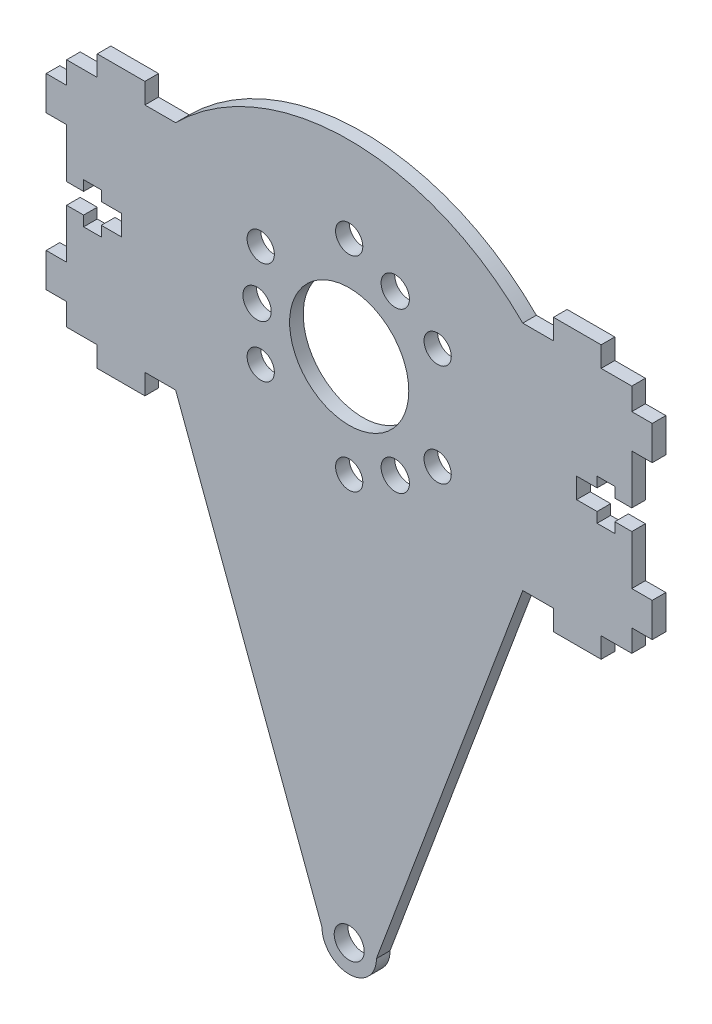
from build123d import *

# Parameters (mm, degrees)
SKETCH_1_R      = 2
SKETCH_1_R_2    = 2.08
SKETCH_1_R_3    = 8.75
SKETCH_1_R_4    = 2.2
EXTRUDE_2_DEPTH = 2


with BuildPart() as part:
    # 草图1 → 凸台-拉伸2 (new body)
    with BuildSketch(Plane.XY):
        with BuildLine():
            Line((41.5, 13.75), (41.5, 17))
            Line((41.5, 17), (37, 17))
            Line((37, 17), (37, 20))
            Line((37, 20), (30, 20))
            Line((30, 20), (30, 17))
            Line((30, 17), (25.488968202, 17))
            ThreePointArc((25.488968202, 17), (0, 27.55787632), (-25.488968202, 17))
            Line((-25.488968202, 17), (-30, 17))
            Line((-30, 17), (-30, 20))
            Line((-30, 20), (-37, 20))
            Line((-37, 20), (-37, 17))
            Line((-37, 17), (-41.5, 17))
            Line((-41.5, 17), (-41.5, 13.75))
            Line((-41.5, 13.75), (-44.5, 13.75))
            Line((-44.5, 13.75), (-44.5, 8.75))
            Line((-44.5, 8.75), (-41.5, 8.75))
            Line((-41.5, 8.75), (-41.5, 1.5))
            Line((-41.5, 1.5), (-39, 1.5))
            Line((-39, 1.5), (-39, 3))
            Line((-39, 3), (-36.4, 3))
            Line((-36.4, 3), (-36.4, 1.5))
            Line((-36.4, 1.5), (-33.4, 1.5))
            Line((-33.4, 1.5), (-33.4, -1.5))
            Line((-33.4, -1.5), (-36.4, -1.5))
            Line((-36.4, -1.5), (-36.4, -3))
            Line((-36.4, -3), (-39, -3))
            Line((-39, -3), (-39, -1.5))
            Line((-39, -1.5), (-41.5, -1.5))
            Line((-41.5, -1.5), (-41.5, -8.75))
            Line((-41.5, -8.75), (-44.5, -8.75))
            Line((-44.5, -8.75), (-44.5, -13.75))
            Line((-44.5, -13.75), (-41.5, -13.75))
            Line((-41.5, -13.75), (-41.5, -17))
            Line((-41.5, -17), (-37, -17))
            Line((-37, -17), (-37, -20))
            Line((-37, -20), (-30, -20))
            Line((-30, -20), (-30, -17))
            Line((-30, -17), (-25.488968202, -17))
            Line((-25.488968202, -17), (-4, -74.55787632))
            ThreePointArc((-4, -74.55787632), (0, -78.55787632), (4, -74.55787632))
            Line((4, -74.55787632), (25.488968202, -17))
            Line((25.488968202, -17), (30, -17))
            Line((30, -17), (30, -20))
            Line((30, -20), (37, -20))
            Line((37, -20), (37, -17))
            Line((37, -17), (41.5, -17))
            Line((41.5, -17), (41.5, -13.75))
            Line((41.5, -13.75), (44.5, -13.75))
            Line((44.5, -13.75), (44.5, -8.75))
            Line((44.5, -8.75), (41.5, -8.75))
            Line((41.5, -8.75), (41.5, -1.5))
            Line((41.5, -1.5), (39, -1.5))
            Line((39, -1.5), (39, -3))
            Line((39, -3), (36.4, -3))
            Line((36.4, -3), (36.4, -1.5))
            Line((36.4, -1.5), (33.4, -1.5))
            Line((33.4, -1.5), (33.4, 1.5))
            Line((33.4, 1.5), (36.4, 1.5))
            Line((36.4, 1.5), (36.4, 3))
            Line((36.4, 3), (39, 3))
            Line((39, 3), (39, 1.5))
            Line((39, 1.5), (41.5, 1.5))
            Line((41.5, 1.5), (41.5, 8.75))
            Line((41.5, 8.75), (44.5, 8.75))
            Line((44.5, 8.75), (44.5, 13.75))
            Line((44.5, 13.75), (41.5, 13.75))
        make_face()
        with Locations((0, -15)):
            Circle(SKETCH_1_R, mode=Mode.SUBTRACT)
        with Locations((-12.990381057, -7.5)):
            Circle(SKETCH_1_R, mode=Mode.SUBTRACT)
        with Locations((-12.990381057, 7.5)):
            Circle(SKETCH_1_R, mode=Mode.SUBTRACT)
        with Locations((0, 15)):
            Circle(SKETCH_1_R, mode=Mode.SUBTRACT)
        with Locations((12.990381057, 7.5)):
            Circle(SKETCH_1_R, mode=Mode.SUBTRACT)
        with Locations((12.990381057, -7.5)):
            Circle(SKETCH_1_R, mode=Mode.SUBTRACT)
        with Locations((-13.53, 0)):
            Circle(SKETCH_1_R_2, mode=Mode.SUBTRACT)
        with Locations((6.765, 11.717323713)):
            Circle(SKETCH_1_R_2, mode=Mode.SUBTRACT)
        with Locations((6.765, -11.717323713)):
            Circle(SKETCH_1_R_2, mode=Mode.SUBTRACT)
        Circle(SKETCH_1_R_3, mode=Mode.SUBTRACT)
        with Locations((0, -74.55787632)):
            Circle(SKETCH_1_R_4, mode=Mode.SUBTRACT)
    extrude(amount=EXTRUDE_2_DEPTH)


solid = part.part
